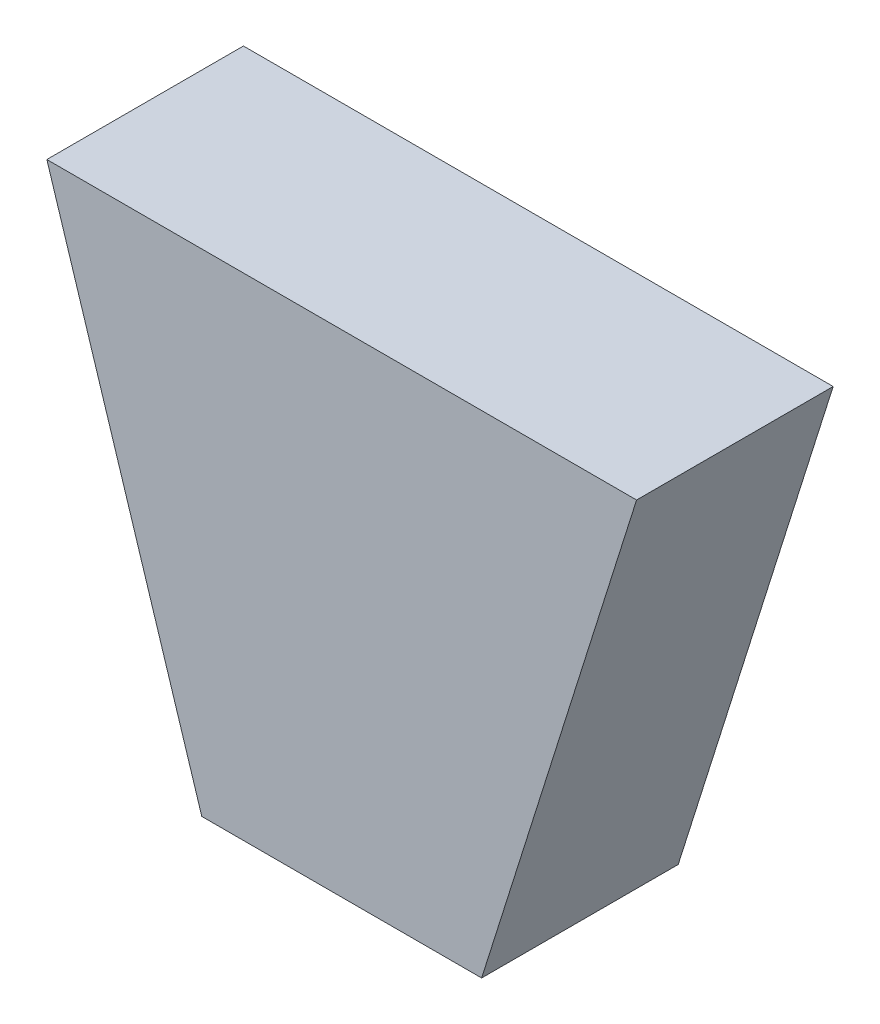
from build123d import *

# Parameters (mm, degrees)
EXTRUDE_1_DEPTH = 20


with BuildPart() as part:
    # Эскиз1 → Бобышка-Вытянуть1 (new body)
    with BuildSketch(Plane.XY):
        Polygon((0, 0), (-15.764939444, 50), (44.235060556, 50), (28.470121112, 0), align=None)
    extrude(amount=EXTRUDE_1_DEPTH)


solid = part.part
